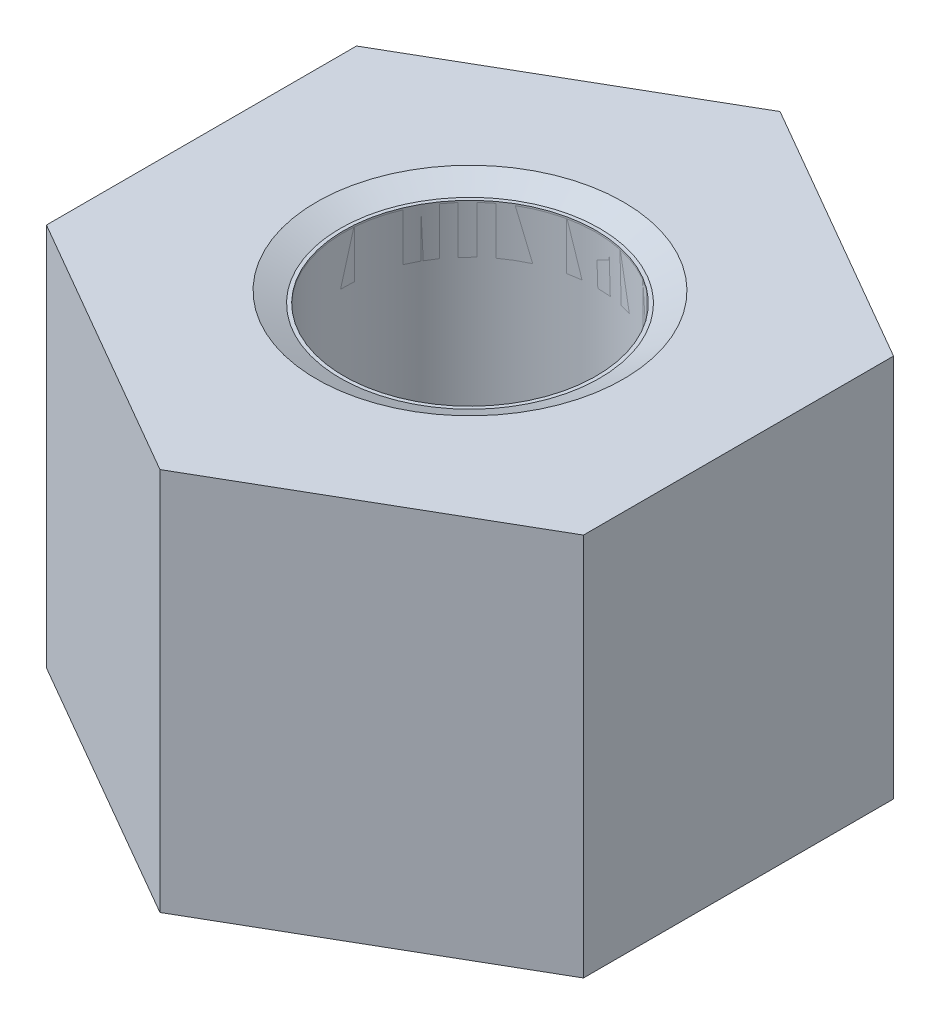
from build123d import *

# Parameters (mm, degrees)
EXTRUDE1_DEPTH = 7.9375


with BuildPart() as part:
    # Sketch1 → Extrude1 (new body)
    with BuildSketch(Plane(origin=(0, 0, 0), x_dir=(1, 0, 0), z_dir=(0, 1, 0))):
        Polygon((0, 6.415804866), (-5.55625, 3.207902433), (-5.55625, -3.207902433), (0, -6.415804866), (5.55625, -3.207902433), (5.55625, 3.207902433), align=None)
    extrude(amount=EXTRUDE1_DEPTH)

    # Sketch4 → Cut-Revolve2 (revolve, cut)
    with BuildSketch(Plane(origin=(0, 0, 0), x_dir=(0, 0, -1), z_dir=(1, 0, 0))):
        Polygon((0, 7.9375), (3.175, 7.9375), (2.609908356, 7.673993439), (2.609908356, 0.263506561), (3.175, 0), (0, 0), align=None)
    revolve(axis=Axis((0, 7.9375, 0), (0, 1, 0)), mode=Mode.SUBTRACT)


with BuildPart() as body_2:
    # Sketch7 → Revolve2 (revolve)
    with BuildSketch(Plane(origin=(0, 0, 0), x_dir=(0, 0, -1), z_dir=(1, 0, 0))):
        with BuildLine():
            Line((2.609908356, 6.690783333), (5.324993778, 6.690783333))
            ThreePointArc((5.324993778, 6.690783333), (4.979705237, 7.4148695), (4.233333333, 7.7089))
            Line((4.233333333, 7.7089), (2.609908356, 7.7089))
            Line((2.609908356, 7.7089), (2.609908356, 6.690783333))
        make_face()
    revolve(axis=Axis((0, 6.690783333, 0), (0, 1, 0)))


solid = Compound([part.part, body_2.part])
